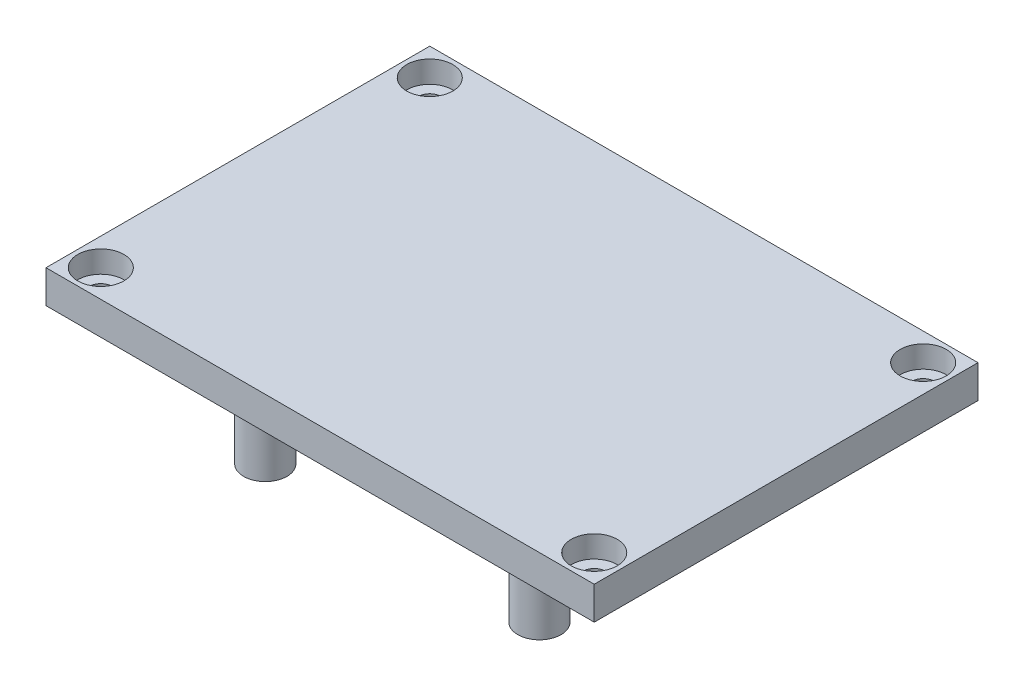
from build123d import *

# Parameters (mm, degrees)
AUFSATZ_LINEAR_AUSTRAGEN1_DEPTH = 6
AUFSATZ_LINEAR_AUSTRAGEN2_DEPTH = 2
SKIZZE3_OUTSIDE_W               = 126.466
SKIZZE3_OUTSIDE_H               = 96.466
SKIZZE3_OUTSIDE_W_2             = 100
SKIZZE3_OUTSIDE_H_2             = 70
SKIZZE3_OUTSIDE_R               = 2.1
SCHNITT_LINEAR_AUSTRAGEN1_DEPTH = 6
SKIZZE4_R                       = 4.2
SCHNITT_LINEAR_AUSTRAGEN2_DEPTH = 4
SKIZZE5_R                       = 3.95
SKIZZE5_R_2                     = 1.45
AUFSATZ_LINEAR_AUSTRAGEN3_DEPTH = 20


with BuildPart() as part:
    # Skizze1 → Aufsatz-Linear austragen1 (new body)
    with BuildSketch(Plane(origin=(0, 0, 0), x_dir=(1, 0, 0), z_dir=(0, 1, 0))):
        Polygon((-50, -35), (50, -35), (50, 35), (-15.02457838, 35), (-35.02457838, 35), (-50, 35), align=None)
    extrude(amount=AUFSATZ_LINEAR_AUSTRAGEN1_DEPTH)

    # Skizze2 → Aufsatz-Linear austragen2 (add)
    with BuildSketch(Plane(origin=(0, 0, 0), x_dir=(-1, 0, 0), z_dir=(0, -1, 0))):
        with BuildLine():
            Line((39.65, -32.75), (-39.65, -32.75))
            Line((-39.65, -32.75), (-39.65, -30))
            ThreePointArc((-39.65, -30), (-41.216978721, -26.216978721), (-45, -24.65))
            Line((-45, -24.65), (-47.75, -24.65))
            Line((-47.75, -24.65), (-47.75, 24.65))
            Line((-47.75, 24.65), (-45, 24.65))
            ThreePointArc((-45, 24.65), (-41.216978721, 26.216978721), (-39.65, 30))
            Line((-39.65, 30), (-39.65, 32.75))
            Line((-39.65, 32.75), (39.65, 32.75))
            Line((39.65, 32.75), (39.65, 30))
            ThreePointArc((39.65, 30), (41.216978721, 26.216978721), (45, 24.65))
            Line((45, 24.65), (47.75, 24.65))
            Line((47.75, 24.65), (47.75, -24.65))
            Line((47.75, -24.65), (45, -24.65))
            ThreePointArc((45, -24.65), (41.216978721, -26.216978721), (39.65, -30))
            Line((39.65, -30), (39.65, -32.75))
        make_face()
        with BuildLine():
            Line((45.75, 22.65), (45.75, -22.65))
            Line((45.75, -22.65), (45, -22.65))
            ThreePointArc((45, -22.65), (39.802765158, -24.802765158), (37.65, -30))
            Line((37.65, -30), (37.65, -30.75))
            Line((37.65, -30.75), (-37.65, -30.75))
            Line((-37.65, -30.75), (-37.65, -30))
            ThreePointArc((-37.65, -30), (-39.802765158, -24.802765158), (-45, -22.65))
            Line((-45, -22.65), (-45.75, -22.65))
            Line((-45.75, -22.65), (-45.75, 22.65))
            Line((-45.75, 22.65), (-45, 22.65))
            ThreePointArc((-45, 22.65), (-39.802765158, 24.802765158), (-37.65, 30))
            Line((-37.65, 30), (-37.65, 30.75))
            Line((-37.65, 30.75), (37.65, 30.75))
            Line((37.65, 30.75), (37.65, 30))
            ThreePointArc((37.65, 30), (39.802765158, 24.802765158), (45, 22.65))
            Line((45, 22.65), (45.75, 22.65))
        make_face(mode=Mode.SUBTRACT)
    extrude(amount=AUFSATZ_LINEAR_AUSTRAGEN2_DEPTH)

    # Skizze3 outside → Schnitt-Linear austragen1 (cut)
    # profile 1 of 5: a face of its own
    with BuildSketch(Plane(origin=(0, 6, 0), x_dir=(1, 0, 0), z_dir=(0, 1, 0))):
        Rectangle(SKIZZE3_OUTSIDE_W, SKIZZE3_OUTSIDE_H)
        Rectangle(SKIZZE3_OUTSIDE_W_2, SKIZZE3_OUTSIDE_H_2, mode=Mode.SUBTRACT)
    # profile 2 of 5: a face of its own
    with BuildSketch(Plane(origin=(0, 6, 0), x_dir=(1, 0, 0), z_dir=(0, 1, 0))):
        with Locations(Location((-45, -30, 0), (0, 0, 270))):
            Circle(SKIZZE3_OUTSIDE_R)
    # profile 3 of 5: a face of its own
    with BuildSketch(Plane(origin=(0, 6, 0), x_dir=(1, 0, 0), z_dir=(0, 1, 0))):
        with Locations(Location((-45, 30, 0), (0, 0, 270))):
            Circle(SKIZZE3_OUTSIDE_R)
    # profile 4 of 5: a face of its own
    with BuildSketch(Plane(origin=(0, 6, 0), x_dir=(1, 0, 0), z_dir=(0, 1, 0))):
        with Locations(Location((45, -30, 0), (0, 0, 270))):
            Circle(SKIZZE3_OUTSIDE_R)
    # profile 5 of 5: a face of its own
    with BuildSketch(Plane(origin=(0, 6, 0), x_dir=(1, 0, 0), z_dir=(0, 1, 0))):
        with Locations(Location((45, 30, 0), (0, 0, 270))):
            Circle(SKIZZE3_OUTSIDE_R)
    extrude(amount=-SCHNITT_LINEAR_AUSTRAGEN1_DEPTH, mode=Mode.SUBTRACT)

    # Skizze4 → Schnitt-Linear austragen2 (cut)
    with BuildSketch(Plane(origin=(0, 6, 0), x_dir=(1, 0, 0), z_dir=(0, 1, 0))):
        with Locations(Location((-45, -30, 0), (0, 0, 270))):
            Circle(SKIZZE4_R)
        with Locations(Location((45, -30, 0), (0, 0, 270))):
            Circle(SKIZZE4_R)
        with Locations(Location((45, 30, 0), (0, 0, 270))):
            Circle(SKIZZE4_R)
        with Locations(Location((-45, 30, 0), (0, 0, 270))):
            Circle(SKIZZE4_R)
    extrude(amount=-SCHNITT_LINEAR_AUSTRAGEN2_DEPTH, mode=Mode.SUBTRACT)

    # Skizze5 → Aufsatz-Linear austragen3 (add)
    # profile 1 of 4: a face of its own
    with BuildSketch(Plane(origin=(0, 0, 0), x_dir=(-1, 0, 0), z_dir=(0, -1, 0))):
        with Locations(Location((25, -20, 0), (0, 0, 270))):
            Circle(SKIZZE5_R)
        with Locations(Location((25, -20, 0), (0, 0, 90))):
            Circle(SKIZZE5_R_2, mode=Mode.SUBTRACT)
    # profile 2 of 4: a face of its own
    with BuildSketch(Plane(origin=(0, 0, 0), x_dir=(-1, 0, 0), z_dir=(0, -1, 0))):
        with Locations(Location((-25, -20, 0), (0, 0, 270))):
            Circle(SKIZZE5_R)
        with Locations(Location((-25, -20, 0), (0, 0, 270))):
            Circle(SKIZZE5_R_2, mode=Mode.SUBTRACT)
    # profile 3 of 4: a face of its own
    with BuildSketch(Plane(origin=(0, 0, 0), x_dir=(-1, 0, 0), z_dir=(0, -1, 0))):
        with Locations(Location((-25, 20, 0), (0, 0, 270))):
            Circle(SKIZZE5_R)
        with Locations(Location((-25, 20, 0), (0, 0, 90))):
            Circle(SKIZZE5_R_2, mode=Mode.SUBTRACT)
    # profile 4 of 4: a face of its own
    with BuildSketch(Plane(origin=(0, 0, 0), x_dir=(-1, 0, 0), z_dir=(0, -1, 0))):
        with Locations(Location((25, 20, 0), (0, 0, 270))):
            Circle(SKIZZE5_R)
        with Locations(Location((25, 20, 0), (0, 0, 270))):
            Circle(SKIZZE5_R_2, mode=Mode.SUBTRACT)
    extrude(amount=AUFSATZ_LINEAR_AUSTRAGEN3_DEPTH)


solid = part.part
